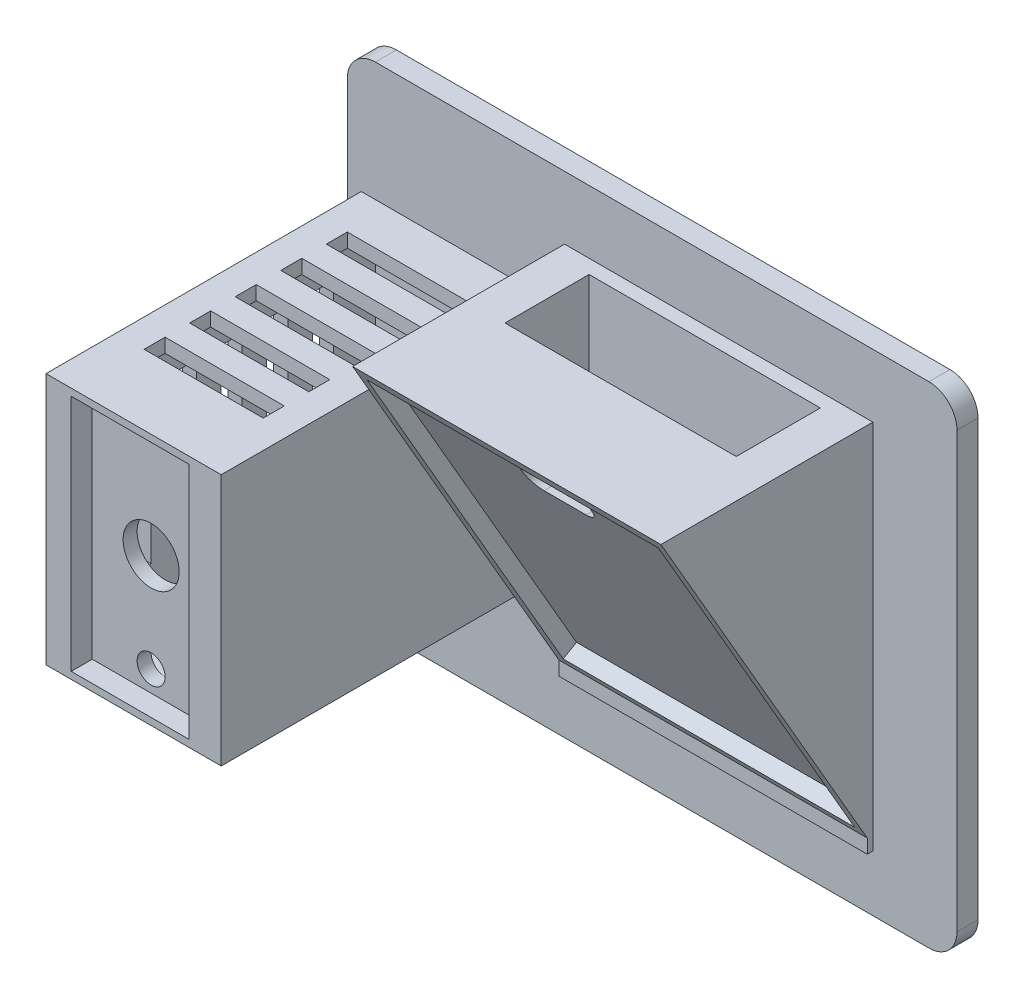
from build123d import *

# Parameters (mm, degrees)
BASE_PLATE_DEPTH                = 3
RAIN_PLATE_WEDGE_DEPTH          = 44
RAIN_PLATE_POCKET_DEPTH         = 20.8
SKETCH4_W                       = 33
SKETCH4_H                       = 12
LM393_BOARD_POCKET_DEPTH        = 9.5
RAIN_PLATE_PIN_HOLE_DEPTH       = 15
SKETCH6_W                       = 25
SKETCH6_H                       = 36
SKETCH6_W_2                     = 21
SKETCH6_H_2                     = 32
DHT11_SCREEN_WALLS_DEPTH        = 40
SKETCH7_W                       = 25
SKETCH7_H                       = 36
DHT11_SCREEN_ROOF_DEPTH         = 5
SKETCH8_W                       = 16.8
SKETCH8_H                       = 34
LDR_MODULE_POCKET_DEPTH         = 1.75
SKETCH9_R                       = 2
SKETCH9_R_2                     = 4
LDR_AND_SCREEN_WIRE_HOLES_DEPTH = 1.5
SKETCH10_R                      = 4
DHT11_WIRE_HOLE_DEPTH           = 2
SKETCH11_R                      = 1
FILAMENT_PIN_HOLES_DEPTH        = 1.55
SKETCH12_W                      = 3
SKETCH12_H                      = 22
LOUVRES_BACK_DEPTH              = 2
SKETCH13_W                      = 17
SKETCH13_H                      = 3
LOUVRES_STBD_DEPTH              = 2
SKETCH14_W                      = 17
SKETCH14_H                      = 3
LOUVRES_PORT_DEPTH              = 2


with BuildPart() as part:
    # Sketch1 → Base_plate (new body)
    with BuildSketch(Plane.XY.offset(373.2)):
        with BuildLine():
            Line((-131, -35), (-52, -35))
            ThreePointArc((-52, -35), (-49.171572875, -33.828427125), (-48, -31))
            Line((-48, -31), (-48, 31))
            ThreePointArc((-48, 31), (-49.171572875, 33.828427125), (-52, 35))
            Line((-52, 35), (-131, 35))
            ThreePointArc((-131, 35), (-133.828427125, 33.828427125), (-135, 31))
            Line((-135, 31), (-135, -31))
            ThreePointArc((-135, -31), (-133.828427125, -33.828427125), (-131, -35))
        make_face()
    extrude(amount=BASE_PLATE_DEPTH)

    # Sketch2 → Rain_plate_wedge (add)
    with BuildSketch(Plane(origin=(-104, 0, 0), x_dir=(0, 0, -1), z_dir=(1, 0, 0))):
        Polygon((-376.19, -27), (-376.19, 26), (-406.444863729, 26), (-377, -25), (-377, -27), align=None)
    extrude(amount=RAIN_PLATE_WEDGE_DEPTH)

    # Sketch3 → Rain_plate_pocket (cut, symmetric)
    with BuildSketch(Plane(origin=(-82, 0, 0), x_dir=(0, 0, -1), z_dir=(1, 0, 0))):
        Polygon((-377.859807621, -24.110769515), (-405.859807621, 24.386653096), (-403.694744112, 25.636653096), (-375.694744112, -22.860769515), align=None)
    extrude(amount=RAIN_PLATE_POCKET_DEPTH, both=True, mode=Mode.SUBTRACT)

    # Sketch4 → LM393_board_pocket (cut, symmetric)
    with BuildSketch(Plane(origin=(0, 17.5, 0), x_dir=(1, 0, 0), z_dir=(0, 1, 0))):
        with Locations((-82, -384.2)):
            Rectangle(SKETCH4_W, SKETCH4_H)
    extrude(amount=LM393_BOARD_POCKET_DEPTH, both=True, mode=Mode.SUBTRACT)

    # Sketch5 → Rain_plate_pin_hole (cut, symmetric)
    with BuildSketch(Plane.XY.offset(404.7)):
        with BuildLine():
            Line((-85, 16), (-79, 16))
            ThreePointArc((-79, 16), (-77.585786438, 16.585786438), (-77, 18))
            Line((-77, 18), (-77, 22))
            ThreePointArc((-77, 22), (-77.585786438, 23.414213562), (-79, 24))
            Line((-79, 24), (-85, 24))
            ThreePointArc((-85, 24), (-86.414213562, 23.414213562), (-87, 22))
            Line((-87, 22), (-87, 18))
            ThreePointArc((-87, 18), (-86.414213562, 16.585786438), (-85, 16))
        make_face()
    extrude(amount=RAIN_PLATE_PIN_HOLE_DEPTH, both=True, mode=Mode.SUBTRACT)

    # Sketch6 → DHT11_screen_walls (add)
    with BuildSketch(Plane.XY.offset(376.2)):
        with Locations((-120.5, 0)):
            Rectangle(SKETCH6_W, SKETCH6_H)
        with Locations((-120.5, 0)):
            Rectangle(SKETCH6_W_2, SKETCH6_H_2, mode=Mode.SUBTRACT)
    extrude(amount=DHT11_SCREEN_WALLS_DEPTH)

    # Sketch7 → DHT11_screen_roof (add)
    with BuildSketch(Plane.XY.offset(416.2)):
        with Locations((-120.5, 0)):
            Rectangle(SKETCH7_W, SKETCH7_H)
    extrude(amount=DHT11_SCREEN_ROOF_DEPTH)

    # Sketch8 → LDR_module_pocket (cut, symmetric)
    with BuildSketch(Plane.XY.offset(419.95)):
        with Locations((-121, 0)):
            Rectangle(SKETCH8_W, SKETCH8_H)
    extrude(amount=LDR_MODULE_POCKET_DEPTH, both=True, mode=Mode.SUBTRACT)

    # Sketch9 → LDR_and_screen_wire_holes (cut, symmetric)
    with BuildSketch(Plane.XY.offset(417.2)):
        with Locations((-121, -14)):
            Circle(SKETCH9_R)
        with Locations((-121, 0)):
            Circle(SKETCH9_R_2)
    extrude(amount=LDR_AND_SCREEN_WIRE_HOLES_DEPTH, both=True, mode=Mode.SUBTRACT)

    # Sketch10 → DHT11_wire_hole (cut, symmetric)
    with BuildSketch(Plane.XY.offset(374.7)):
        with Locations((-121, 0)):
            Circle(SKETCH10_R)
    extrude(amount=DHT11_WIRE_HOLE_DEPTH, both=True, mode=Mode.SUBTRACT)

    # Sketch11 → Filament_pin_holes (cut, symmetric)
    with BuildSketch(Plane.XY.offset(374.25)):
        with Locations((-90, 20)):
            Circle(SKETCH11_R)
        with Locations((-90, -20)):
            Circle(SKETCH11_R)
    extrude(amount=FILAMENT_PIN_HOLES_DEPTH, both=True, mode=Mode.SUBTRACT)

    # Sketch12 → Louvres_back (cut, symmetric)
    with BuildSketch(Plane(origin=(-132, 0, 0), x_dir=(0, 0, -1), z_dir=(1, 0, 0))):
        with Locations((-383.7, 0)):
            Rectangle(SKETCH12_W, SKETCH12_H)
        with Locations((-390.2, 0)):
            Rectangle(SKETCH12_W, SKETCH12_H)
        with Locations((-396.7, 0)):
            Rectangle(SKETCH12_W, SKETCH12_H)
        with Locations((-403.2, 0)):
            Rectangle(SKETCH12_W, SKETCH12_H)
        with Locations((-409.7, 0)):
            Rectangle(SKETCH12_W, SKETCH12_H)
    extrude(amount=LOUVRES_BACK_DEPTH, both=True, mode=Mode.SUBTRACT)

    # Sketch13 → Louvres_stbd (cut, symmetric)
    with BuildSketch(Plane(origin=(0, 17, 0), x_dir=(1, 0, 0), z_dir=(0, 1, 0))):
        with Locations((-120.5, -383.7)):
            Rectangle(SKETCH13_W, SKETCH13_H)
        with Locations((-120.5, -390.2)):
            Rectangle(SKETCH13_W, SKETCH13_H)
        with Locations((-120.5, -396.7)):
            Rectangle(SKETCH13_W, SKETCH13_H)
        with Locations((-120.5, -403.2)):
            Rectangle(SKETCH13_W, SKETCH13_H)
        with Locations((-120.5, -409.7)):
            Rectangle(SKETCH13_W, SKETCH13_H)
    extrude(amount=LOUVRES_STBD_DEPTH, both=True, mode=Mode.SUBTRACT)

    # Sketch14 → Louvres_port (cut, symmetric)
    with BuildSketch(Plane(origin=(0, -17, 0), x_dir=(1, 0, 0), z_dir=(0, 1, 0))):
        with Locations((-120.5, -383.7)):
            Rectangle(SKETCH14_W, SKETCH14_H)
        with Locations((-120.5, -390.2)):
            Rectangle(SKETCH14_W, SKETCH14_H)
        with Locations((-120.5, -396.7)):
            Rectangle(SKETCH14_W, SKETCH14_H)
        with Locations((-120.5, -403.2)):
            Rectangle(SKETCH14_W, SKETCH14_H)
        with Locations((-120.5, -409.7)):
            Rectangle(SKETCH14_W, SKETCH14_H)
    extrude(amount=LOUVRES_PORT_DEPTH, both=True, mode=Mode.SUBTRACT)


solid = part.part
